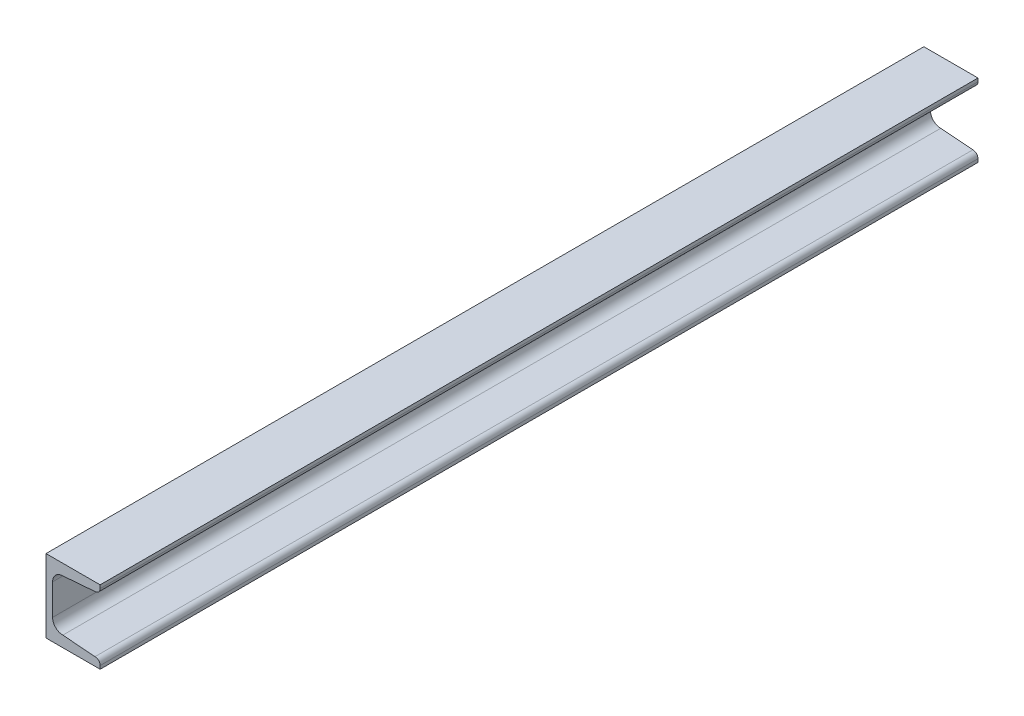
from build123d import *

# Parameters (mm, degrees)
EXTRUDE_1_DEPTH = 600


with BuildPart() as part:
    # 草图1 → 拉伸1 (new body)
    with BuildSketch(Plane.XY):
        with BuildLine():
            Line((4.5, 35.525), (4.5, 14.475))
            ThreePointArc((4.5, 14.475), (6.550252532, 9.525252532), (11.5, 7.475))
            Line((11.5, 7.475), (33.5, 5.725))
            ThreePointArc((33.5, 5.725), (35.974873734, 4.699873734), (37, 2.225))
            Line((37, 2.225), (37, 0))
            Line((37, 0), (0, 0))
            Line((0, 0), (0, 50))
            Line((0, 50), (37, 50))
            Line((37, 50), (37, 47.775))
            ThreePointArc((37, 47.775), (35.974873734, 45.300126266), (33.5, 44.275))
            Line((33.5, 44.275), (11.5, 42.525))
            ThreePointArc((11.5, 42.525), (6.550252532, 40.474747468), (4.5, 35.525))
        make_face()
        with BuildLine():
            Line((0, 50), (0, 25))
            Line((0, 25), (4.5, 25))
            Line((4.5, 25), (4.5, 35.525))
            ThreePointArc((4.5, 35.525), (6.550252532, 40.474747468), (11.5, 42.525))
            Line((11.5, 42.525), (33.5, 44.275))
            ThreePointArc((33.5, 44.275), (35.974873734, 45.300126266), (37, 47.775))
            Line((37, 47.775), (37, 50))
            Line((37, 50), (0, 50))
        make_face()
    extrude(amount=EXTRUDE_1_DEPTH)


solid = part.part
